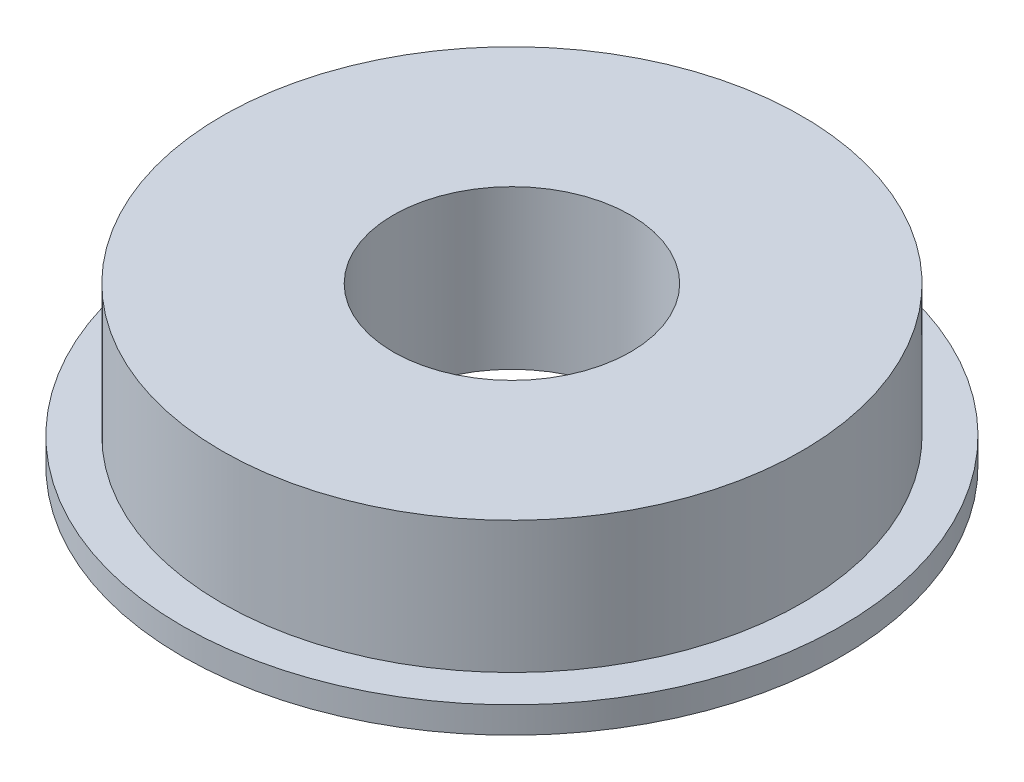
from build123d import *

# Parameters (mm, degrees)
SKETCH1_R               = 12.5
SKETCH1_R_2             = 4.5
BOSS_EXTRUDE1_DEPTH     = 1
SKETCH2_R               = 11
BOSS_EXTRUDE2_DEPTH     = 5
CUT_EXTRUDE1_DEPTH      = 19.371173071
CUT_EXTRUDE1_DEPTH_BACK = 19.371173071
SKETCH3_R               = 4.5


with BuildPart() as part:
    # Sketch1 → Boss-Extrude1 (new body)
    with BuildSketch(Plane(origin=(0, 0, 0), x_dir=(1, 0, 0), z_dir=(0, 1, 0))):
        with Locations(Location((0, 0, 0), (0, 0, 270))):
            Circle(SKETCH1_R)
        with Locations(Location((0, 0, 0), (0, 0, 270))):
            Circle(SKETCH1_R_2, mode=Mode.SUBTRACT)
    extrude(amount=BOSS_EXTRUDE1_DEPTH)

    # Sketch2 → Boss-Extrude2 (add)
    with BuildSketch(Plane(origin=(0, 1, 0), x_dir=(1, 0, 0), z_dir=(0, 1, 0))):
        with Locations(Location((0, 0, 0), (0, 0, 270))):
            Circle(SKETCH2_R)
    extrude(amount=BOSS_EXTRUDE2_DEPTH)

    # Sketch3 → Cut-Extrude1 (cut, two sides: drawn at the far end of the back side and taken through both)
    with BuildSketch(Plane.XZ.offset(-1).offset(-CUT_EXTRUDE1_DEPTH_BACK)):
        with Locations(Location((0, 0, 0), (0, 0, 270))):
            Circle(SKETCH3_R)
    extrude(amount=CUT_EXTRUDE1_DEPTH + CUT_EXTRUDE1_DEPTH_BACK, mode=Mode.SUBTRACT)


solid = part.part
